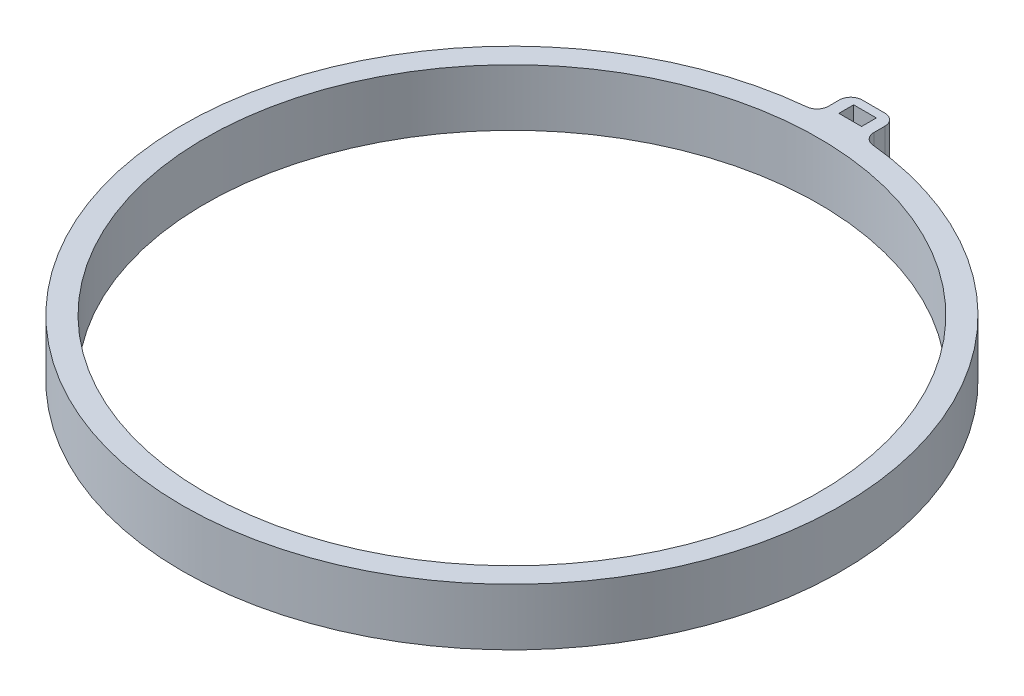
from build123d import *

# Parameters (mm, degrees)
ESBO_O1_R                = 29
ESBO_O1_R_2              = 27
RESSALTO_EXTRUS_O1_DEPTH = 5
ESBO_O2_W                = 4
ESBO_O2_H                = 4
RESSALTO_EXTRUS_O2_DEPTH = 5
FILETE1_R                = 1
ESBO_O3_W                = 2
ESBO_O3_H                = 1.302391812
CORTE_EXTRUS_O1_DEPTH    = 44.337755413


with BuildPart() as part:
    # Esboço1 → Ressalto-extrusão1 (new body)
    with BuildSketch(Plane(origin=(0, 0, 0), x_dir=(1, 0, 0), z_dir=(0, 1, 0))):
        with Locations(Location((0, 0, 0), (0, 0, 270))):
            Circle(ESBO_O1_R)
        with Locations(Location((0, 0, 0), (0, 0, 270))):
            Circle(ESBO_O1_R_2, mode=Mode.SUBTRACT)
    extrude(amount=RESSALTO_EXTRUS_O1_DEPTH)

    # Esboço2 → Ressalto-extrusão2 (add, through all)
    with BuildSketch(Plane(origin=(0, 5, 0), x_dir=(1, 0, 0), z_dir=(0, 1, 0))):
        with Locations((0, 29.814478531)):
            Rectangle(ESBO_O2_W, ESBO_O2_H)
    extrude(amount=-RESSALTO_EXTRUS_O2_DEPTH)

    # Filete1
    filete1_edges = [part.edges().sort_by_distance(p)[0] for p in [
        (-2, 2.5, -28.930952283),
        (2, 2.5, -28.930952283),
        (2, 2.5, -31.814478531),
        (-2, 2.5, -31.814478531),
    ]]
    fillet(filete1_edges, radius=FILETE1_R)

    # Esboço3 → Corte-extrusão1 (cut, through all)
    with BuildSketch(Plane.XZ):
        with Locations((0, -30.417415502)):
            Rectangle(ESBO_O3_W, ESBO_O3_H)
    extrude(amount=-CORTE_EXTRUS_O1_DEPTH, mode=Mode.SUBTRACT)


solid = part.part
